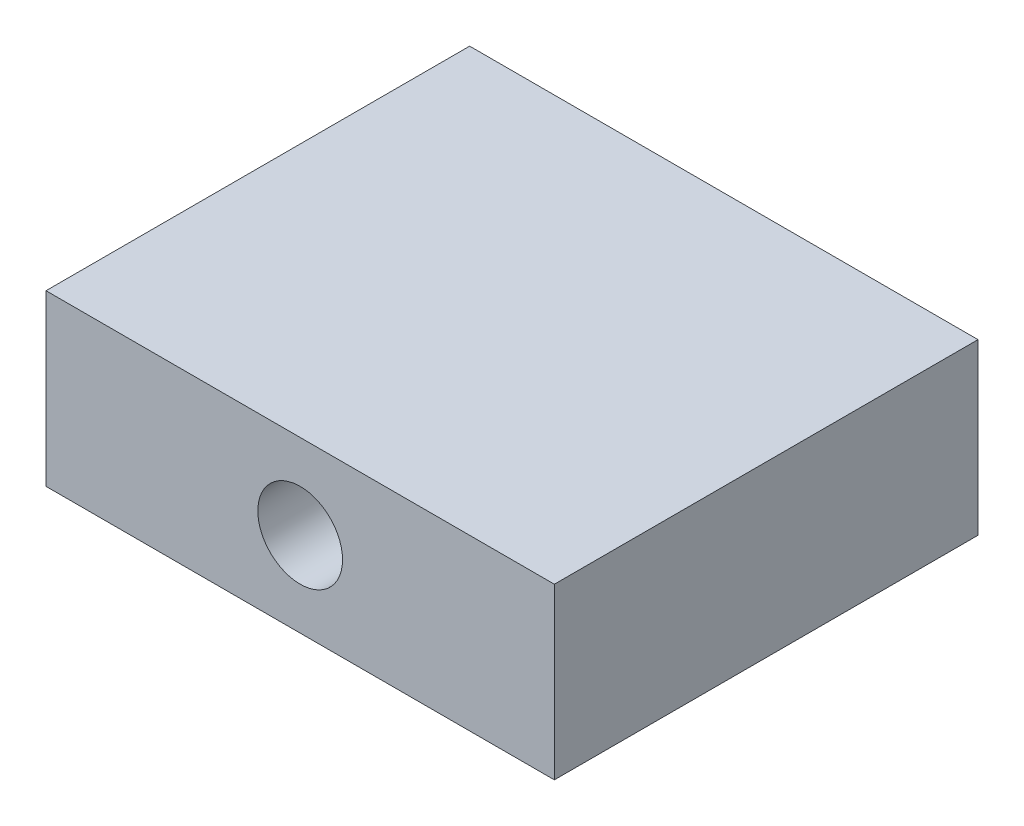
from build123d import *

# Parameters (mm, degrees)
SKETCH_1_W      = 60
SKETCH_1_H      = 20
SKETCH_1_R      = 5
EXTRUDE_1_DEPTH = 25


with BuildPart() as part:
    # 草圖1 → 填料-伸長1 (new, symmetric)
    with BuildSketch(Plane.XY):
        with Locations((30, 10)):
            Rectangle(SKETCH_1_W, SKETCH_1_H)
        with Locations((30, 10)):
            Circle(SKETCH_1_R, mode=Mode.SUBTRACT)
    extrude(amount=EXTRUDE_1_DEPTH, both=True)


solid = part.part
